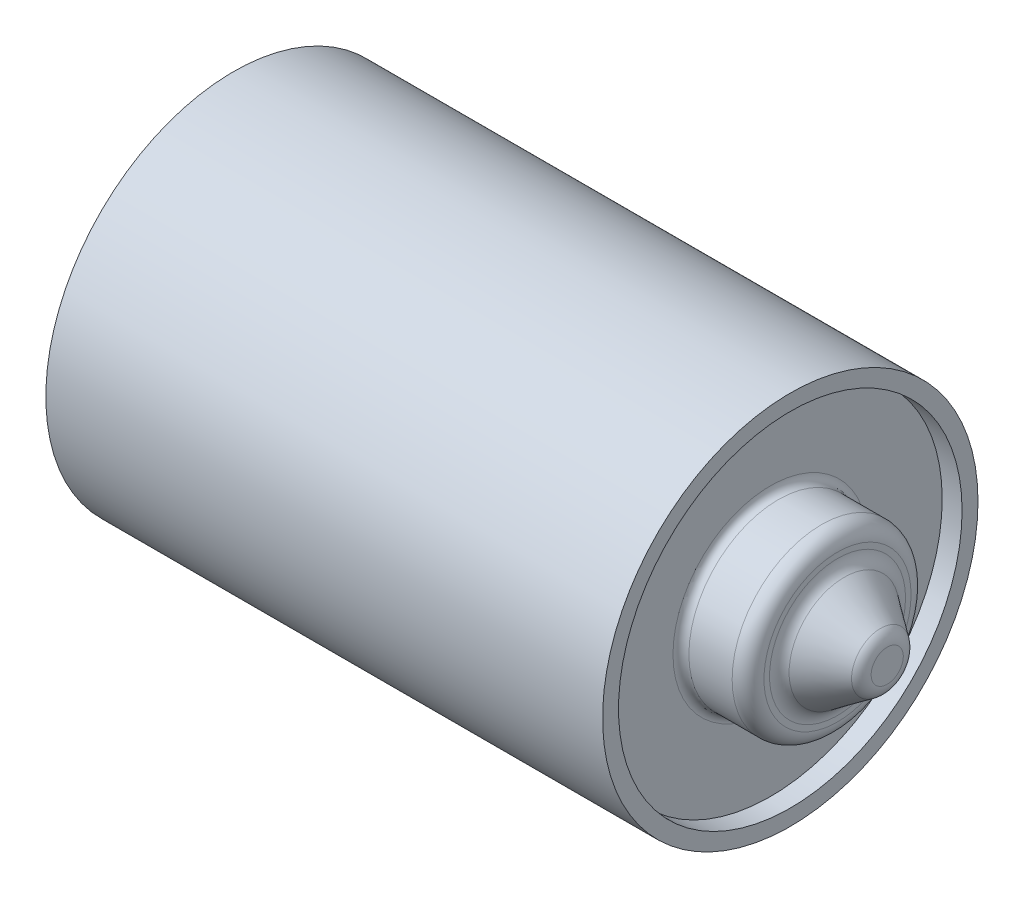
from build123d import *


with BuildPart() as part:
    # Sketch1 → Revolve1 (revolve)
    with BuildSketch(Plane.XY.offset(38.109948098), mode=Mode.PRIVATE) as revolve1_sk:
        with BuildLine():
            Line((670.54800115, 86.792545046), (670.54800115, 56.820545046))
            Line((670.54800115, 56.820545046), (774.926761151, 56.820545046))
            Line((774.926761151, 56.820545046), (774.926761151, 59.38835011))
            ThreePointArc((774.926761151, 59.38835011), (774.645765826, 60.549598522), (773.8649518, 61.453913569))
            Line((773.8649518, 61.453913569), (768.0510705, 65.614533734))
            ThreePointArc((768.0510705, 65.614533734), (767.270256474, 66.518848781), (766.98926115, 67.680097193))
            Line((766.98926115, 67.680097193), (766.98926115, 68.568045046))
            ThreePointArc((766.98926115, 68.568045046), (766.245312374, 70.36409627), (764.44926115, 71.108045046))
            Line((764.44926115, 71.108045046), (757.54300115, 71.108045046))
            ThreePointArc((757.54300115, 71.108045046), (756.644975538, 71.480019434), (756.27300115, 72.378045046))
            Line((756.27300115, 72.378045046), (756.27300115, 84.252545046))
            Line((756.27300115, 84.252545046), (759.44800115, 84.252545046))
            Line((759.44800115, 84.252545046), (759.44800115, 86.792545046))
            Line((759.44800115, 86.792545046), (670.54800115, 86.792545046))
        make_face()
    revolve(revolve1_sk.sketch.rotate(Axis((670.54800115, 56.820545046, 38.109948098), (1, 0, 0)), 270), axis=Axis((670.54800115, 56.820545046, 38.109948098), (1, 0, 0)))


solid = part.part
